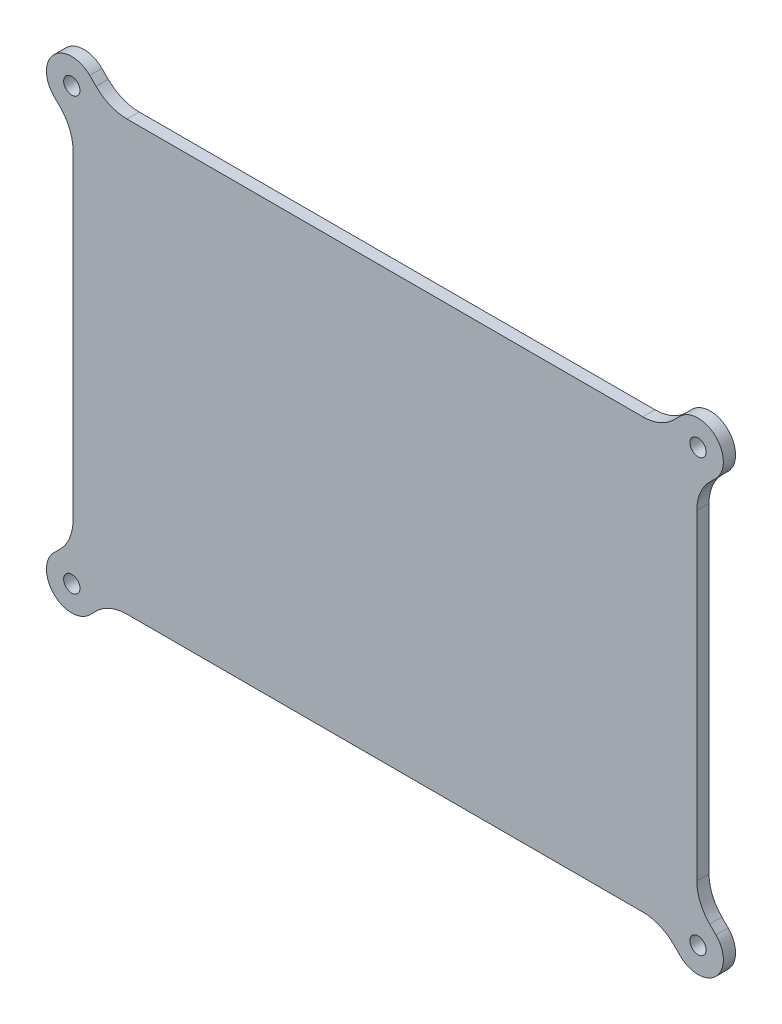
from build123d import *

# Parameters (mm, degrees)
SKETCH1_R           = 2.125
BOSS_EXTRUDE1_DEPTH = 3.175


with BuildPart() as part:
    # Sketch1 → Boss-Extrude1 (new body)
    with BuildSketch(Plane.XY):
        with BuildLine():
            Line((-86.560405869, 44.10222959), (-86.560405869, -39.487929575))
            ThreePointArc((-86.560405869, -39.487929575), (-87.430462813, -43.862001207), (-89.90817536, -47.570160084))
            Line((-89.90817536, -47.570160084), (-91.543789242, -49.205773965))
            ThreePointArc((-91.543789242, -49.205773965), (-91.543789242, -58.556233365), (-82.193329842, -58.556233365))
            Line((-82.193329842, -58.556233365), (-80.557715961, -56.920619483))
            ThreePointArc((-80.557715961, -56.920619483), (-76.849557084, -54.442906936), (-72.475485452, -53.572849992))
            Line((-72.475485452, -53.572849992), (61.914673713, -53.572849992))
            ThreePointArc((61.914673713, -53.572849992), (66.288745345, -54.442906936), (69.996904222, -56.920619483))
            Line((69.996904222, -56.920619483), (71.632518104, -58.556233365))
            ThreePointArc((71.632518104, -58.556233365), (80.982977503, -58.556233365), (80.982977503, -49.205773965))
            Line((80.982977503, -49.205773965), (79.347363622, -47.570160084))
            ThreePointArc((79.347363622, -47.570160084), (76.869651074, -43.862001207), (75.999594131, -39.487929575))
            Line((75.999594131, -39.487929575), (75.999594131, 44.10222959))
            ThreePointArc((75.999594131, 44.10222959), (76.869651074, 48.476301222), (79.347363622, 52.184460099))
            Line((79.347363622, 52.184460099), (80.982977503, 53.820073981))
            ThreePointArc((80.982977503, 53.820073981), (80.982977503, 63.17053338), (71.632518104, 63.17053338))
            Line((71.632518104, 63.17053338), (69.996904222, 61.534919499))
            ThreePointArc((69.996904222, 61.534919499), (66.288745345, 59.057206951), (61.914673713, 58.187150008))
            Line((61.914673713, 58.187150008), (-72.475485452, 58.187150008))
            ThreePointArc((-72.475485452, 58.187150008), (-76.849557084, 59.057206951), (-80.557715961, 61.534919499))
            Line((-80.557715961, 61.534919499), (-82.193329842, 63.17053338))
            ThreePointArc((-82.193329842, 63.17053338), (-91.543789242, 63.17053338), (-91.543789242, 53.820073981))
            Line((-91.543789242, 53.820073981), (-89.90817536, 52.184460099))
            ThreePointArc((-89.90817536, 52.184460099), (-87.430462813, 48.476301222), (-86.560405869, 44.10222959))
        make_face()
        with Locations((-86.868559542, 58.49530368)):
            Circle(SKETCH1_R, mode=Mode.SUBTRACT)
        with Locations((76.307747803, 58.49530368)):
            Circle(SKETCH1_R, mode=Mode.SUBTRACT)
        with Locations((76.307747803, -53.881003665)):
            Circle(SKETCH1_R, mode=Mode.SUBTRACT)
        with Locations((-86.868559542, -53.881003665)):
            Circle(SKETCH1_R, mode=Mode.SUBTRACT)
    extrude(amount=BOSS_EXTRUDE1_DEPTH)


solid = part.part
